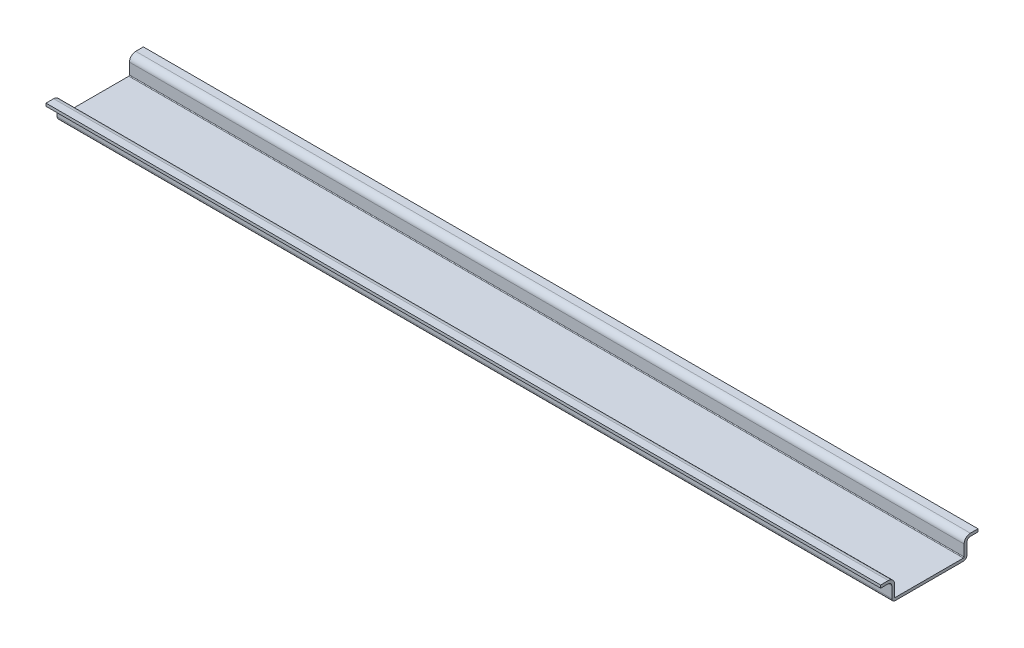
from build123d import *

# Parameters (mm, degrees)
OMEGA_TS_35_1_DEPTH = 300


with BuildPart() as part:
    # Sketch2 → Omega TS-35(1) (new body)
    with BuildSketch(Plane(origin=(-150, 0, 0), x_dir=(0, 0, -1), z_dir=(1, 0, 0))):
        with BuildLine():
            Line((12.25, 0), (-12.25, 0))
            ThreePointArc((-12.25, 0), (-13.133883476, 0.366116524), (-13.5, 1.25))
            Line((-13.5, 1.25), (-13.5, 5.25))
            ThreePointArc((-13.5, 5.25), (-13.866116524, 6.133883476), (-14.75, 6.5))
            Line((-14.75, 6.5), (-17.5, 6.5))
            Line((-17.5, 6.5), (-17.5, 7.5))
            Line((-17.5, 7.5), (-14.75, 7.5))
            ThreePointArc((-14.75, 7.5), (-13.159009742, 6.840990258), (-12.5, 5.25))
            Line((-12.5, 5.25), (-12.5, 1.25))
            ThreePointArc((-12.5, 1.25), (-12.426776695, 1.073223305), (-12.25, 1))
            Line((-12.25, 1), (12.25, 1))
            ThreePointArc((12.25, 1), (12.426776695, 1.073223305), (12.5, 1.25))
            Line((12.5, 1.25), (12.5, 5.25))
            ThreePointArc((12.5, 5.25), (13.159009742, 6.840990258), (14.75, 7.5))
            Line((14.75, 7.5), (17.5, 7.5))
            Line((17.5, 7.5), (17.5, 6.5))
            Line((17.5, 6.5), (14.75, 6.5))
            ThreePointArc((14.75, 6.5), (13.866116524, 6.133883476), (13.5, 5.25))
            Line((13.5, 5.25), (13.5, 1.25))
            ThreePointArc((13.5, 1.25), (13.133883476, 0.366116524), (12.25, 0))
        make_face()
    extrude(amount=OMEGA_TS_35_1_DEPTH)


solid = part.part
